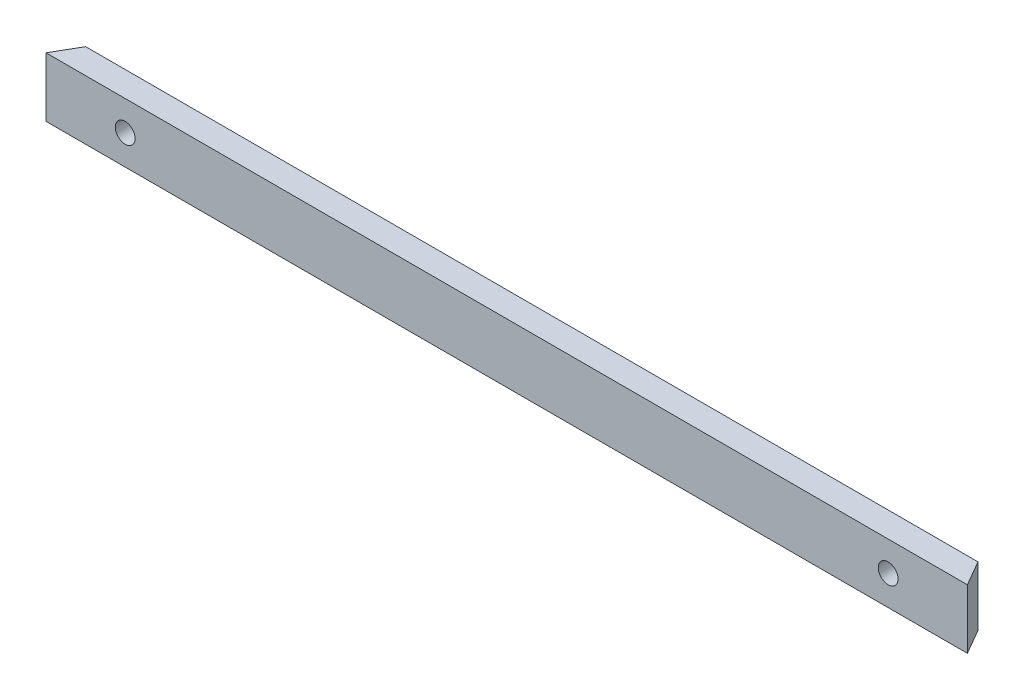
from build123d import *

# Parameters (mm, degrees)
SKETCH1_W           = 232.6676516
SKETCH1_H           = 15
BOSS_EXTRUDE1_DEPTH = 6.35
CUT_EXTRUDE1_DEPTH  = 234.237129551
SKETCH3_R           = 2.5
CUT_EXTRUDE2_DEPTH  = 234.237129551


with BuildPart() as part:
    # Sketch1 → Boss-Extrude1 (new body)
    with BuildSketch(Plane.XY):
        with Locations((116.3338258, 7.5)):
            Rectangle(SKETCH1_W, SKETCH1_H)
    extrude(amount=-BOSS_EXTRUDE1_DEPTH)

    # Sketch2 → Cut-Extrude1 (cut, through all)
    with BuildSketch(Plane(origin=(0, 15, 0), x_dir=(1, 0, 0), z_dir=(0, 1, 0))):
        Polygon((0, 0), (0, 6.35), (3.666174209, 6.35), align=None)
        Polygon((232.6676516, 0), (229.001477391, 6.35), (232.6676516, 6.35), align=None)
    extrude(amount=-CUT_EXTRUDE1_DEPTH, mode=Mode.SUBTRACT)

    # Sketch3 → Cut-Extrude2 (cut, through all)
    with BuildSketch(Plane.XY):
        with Locations((20, 7.5)):
            Circle(SKETCH3_R)
        with Locations((212.6676516, 7.5)):
            Circle(SKETCH3_R)
    extrude(amount=-CUT_EXTRUDE2_DEPTH, mode=Mode.SUBTRACT)


solid = part.part
